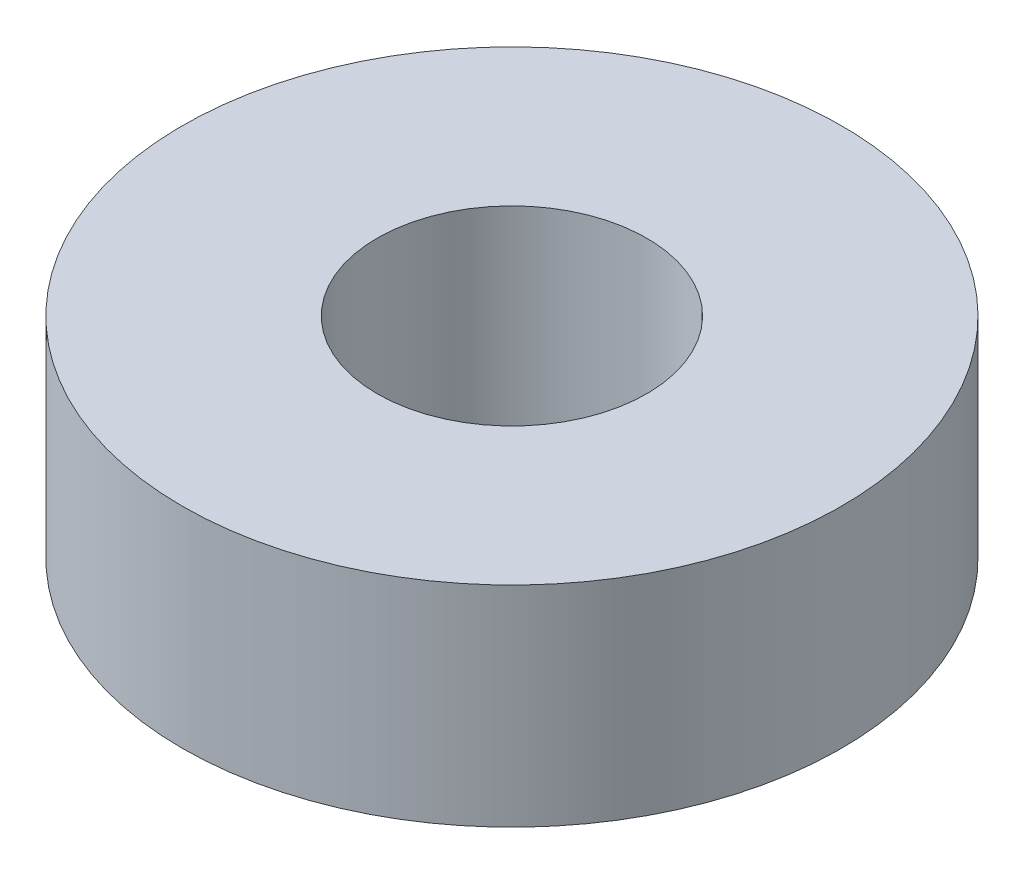
from build123d import *

# Parameters (mm, degrees)
CROQUIS1_R              = 11
CROQUIS1_R_2            = 4.5
SALIENTE_EXTRUIR1_DEPTH = 7


with BuildPart() as part:
    # Croquis1 → Saliente-Extruir1 (new body)
    with BuildSketch(Plane(origin=(0, 0, 0), x_dir=(1, 0, 0), z_dir=(0, 1, 0))):
        with Locations(Location((0, 0, 0), (0, 0, 270))):
            Circle(CROQUIS1_R)
        with Locations(Location((0, 0, 0), (0, 0, 270))):
            Circle(CROQUIS1_R_2, mode=Mode.SUBTRACT)
    extrude(amount=SALIENTE_EXTRUIR1_DEPTH)


solid = part.part
